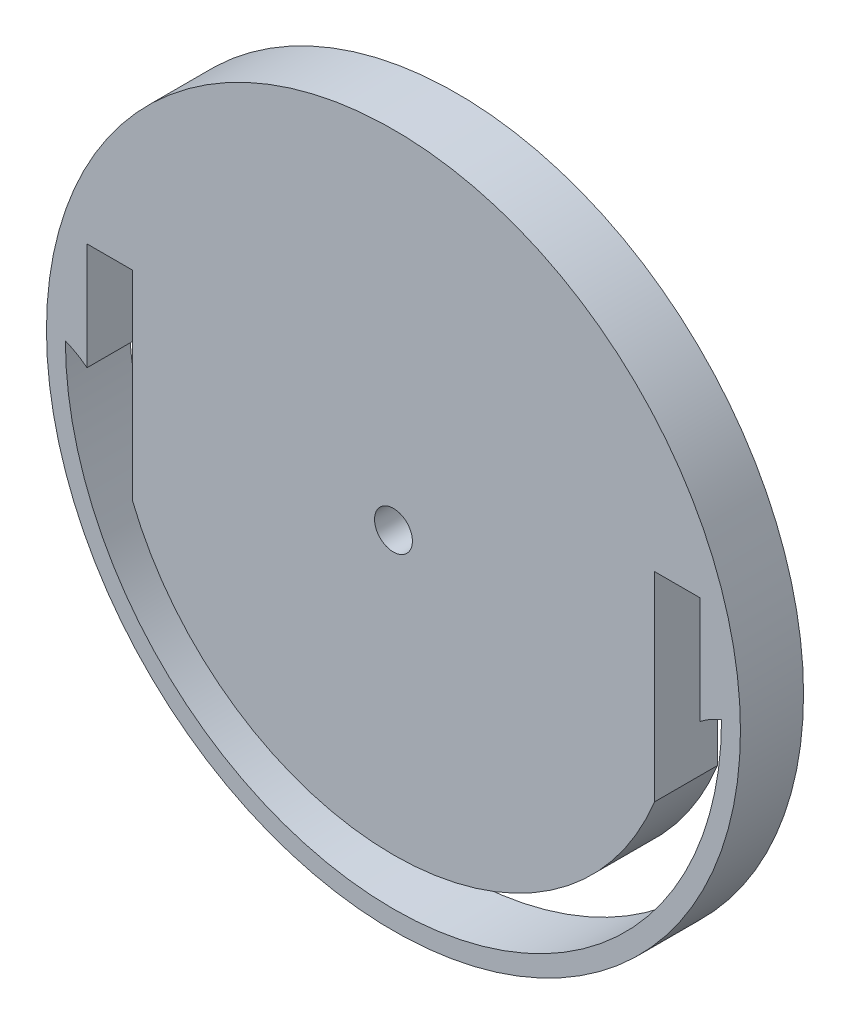
from build123d import *

# Parameters (mm, degrees)
SKETCH1_R           = 55
SKETCH1_R_2         = 3
BOSS_EXTRUDE1_DEPTH = 10
CUT_EXTRUDE1_DEPTH  = 10


with BuildPart() as part:
    # Sketch1 → Boss-Extrude1 (new body)
    with BuildSketch(Plane.XY):
        Circle(SKETCH1_R)
        Circle(SKETCH1_R_2, mode=Mode.SUBTRACT)
    extrude(amount=BOSS_EXTRUDE1_DEPTH)

    # Sketch2 → Cut-Extrude1 (cut)
    with BuildSketch(Plane.XY.offset(10)):
        with BuildLine():
            Line((-48.561950208, 15.019511727), (-41.361950208, 15.019511727))
            Line((-41.361950208, 15.019511727), (-41.361950208, -16.620711788))
            ThreePointArc((-41.361950208, -16.620711788), (0, -44.576439802), (41.361950208, -16.620711788))
            Line((41.361950208, -16.620711788), (41.361950208, 15.019511727))
            Line((41.361950208, 15.019511727), (48.561950208, 15.019511727))
            Line((48.561950208, 15.019511727), (48.561950208, -1.973683231))
            ThreePointArc((48.561950208, -1.973683231), (50.211792907, -0.866329957), (52, 0))
            ThreePointArc((52, 0), (0, -52), (-52, 0))
            ThreePointArc((-52, 0), (-50.211792907, -0.866329957), (-48.561950208, -1.973683231))
            Line((-48.561950208, -1.973683231), (-48.561950208, 15.019511727))
        make_face()
    extrude(amount=-CUT_EXTRUDE1_DEPTH, mode=Mode.SUBTRACT)


solid = part.part
